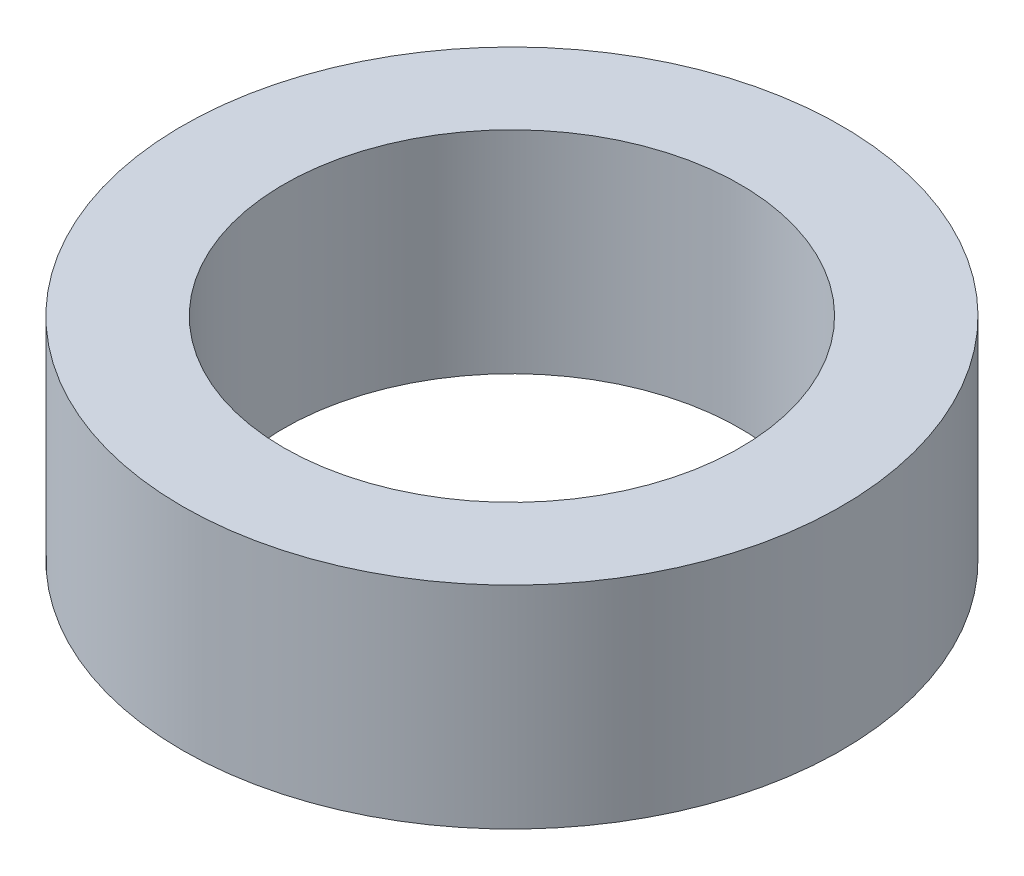
from build123d import *

# Parameters (mm, degrees)
SKETCH_1_R      = 31.2
SKETCH_1_R_2    = 21.6
EXTRUDE_1_DEPTH = 20


with BuildPart() as part:
    # 草图1 → 凸台-拉伸1 (new body)
    with BuildSketch(Plane(origin=(0, 0, 0), x_dir=(1, 0, 0), z_dir=(0, 1, 0))):
        with Locations(Location((0, 0, 0), (0, 0, 270))):
            Circle(SKETCH_1_R)
        with Locations(Location((0, 0, 0), (0, 0, 270))):
            Circle(SKETCH_1_R_2, mode=Mode.SUBTRACT)
    extrude(amount=EXTRUDE_1_DEPTH)


solid = part.part
